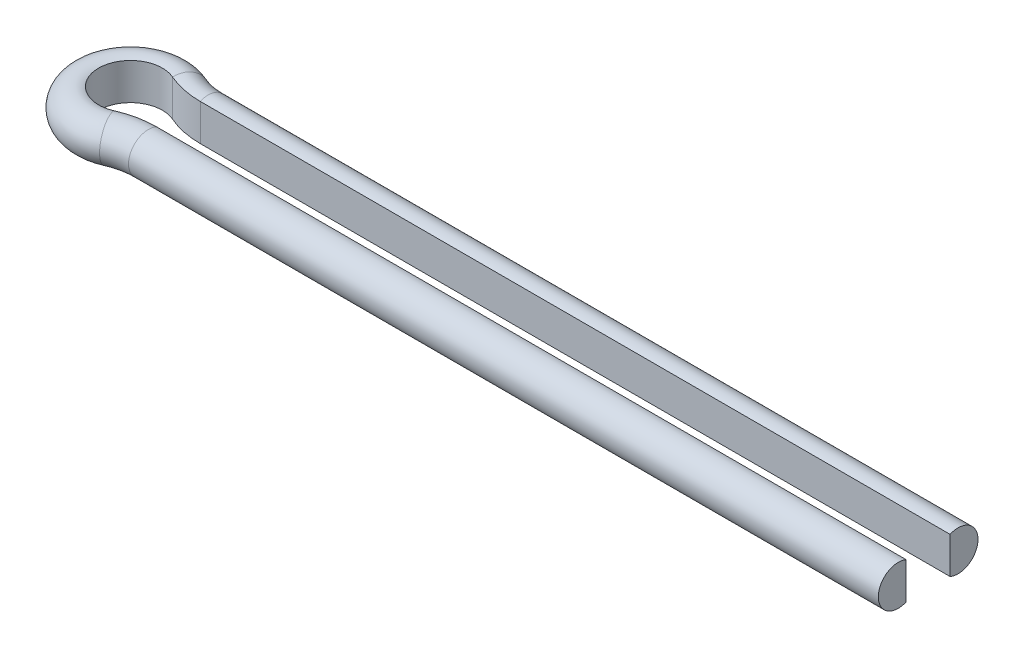
from build123d import *


with BuildPart() as part:
    # Sweep1: sweep along a path in Path
    with BuildLine(Plane(origin=(0, 0, 0), x_dir=(1, 0, 0), z_dir=(0, 1, 0))) as sweep1_path:
        Line((0, 0), (-94.005210596, 0))
        ThreePointArc((-94.005210596, 0), (-96.046452048, 0.210549896), (-98.001736865, 0.833333333))
        ThreePointArc((-98.001736865, 0.833333333), (-105, -3.75), (-98.001736865, -8.333333333))
        ThreePointArc((-98.001736865, -8.333333333), (-96.046452048, -7.710549896), (-94.005210596, -7.5))
        Line((-94.005210596, -7.5), (0, -7.5))
    # Cross-section → Sweep1 (sweep)
    with BuildSketch(Plane(origin=(0, 0, 0), x_dir=(0, 0, -1), z_dir=(1, 0, 0))):
        with BuildLine():
            Line((-1, 2.291287847), (-1, -2.291287847))
            ThreePointArc((-1, -2.291287847), (2.5, 0), (-1, 2.291287847))
        make_face()
    sweep(path=sweep1_path.line)


solid = part.part
